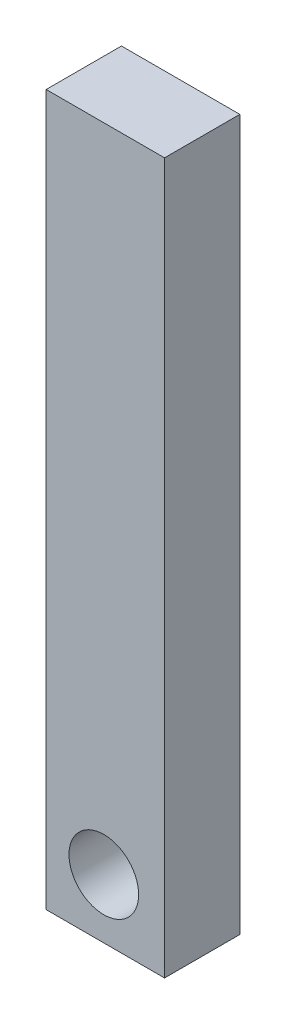
from build123d import *

# Parameters (mm, degrees)
SKETCH1_W           = 5
SKETCH1_H           = 30
SKETCH1_R           = 1.47
BOSS_EXTRUDE1_DEPTH = 3.18


with BuildPart() as part:
    # Sketch1 → Boss-Extrude1 (new body)
    with BuildSketch(Plane.XY):
        with Locations((2.5, 15)):
            Rectangle(SKETCH1_W, SKETCH1_H)
        with Locations(Location((2.43509933, 2.5, 0), (0, 0, 180))):
            Circle(SKETCH1_R, mode=Mode.SUBTRACT)
    extrude(amount=BOSS_EXTRUDE1_DEPTH)


solid = part.part
